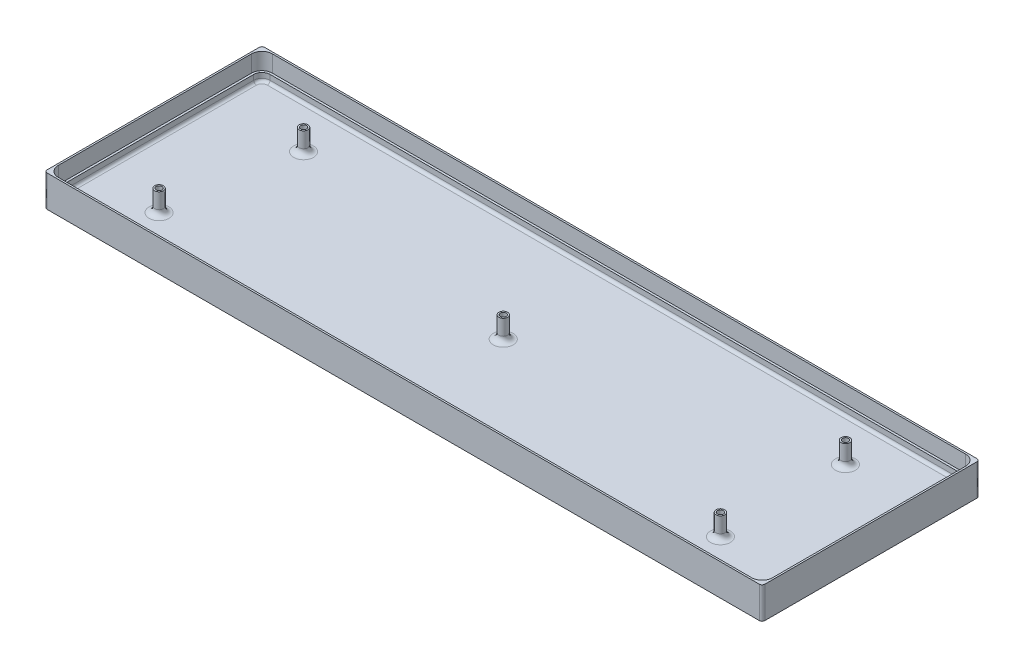
from build123d import *

# Parameters (mm, degrees)
SKETCH1_W           = 327.152
SKETCH1_H           = 99.1616
SKETCH1_W_2         = 325.5518
SKETCH1_H_2         = 97.5614
BOSS_EXTRUDE2_DEPTH = 11.2141
BOSS_EXTRUDE3_START = -11.2141
SKETCH1_3_W         = 327.152
SKETCH1_3_H         = 99.1616
SKETCH1_3_W_2       = 325.5518
SKETCH1_3_H_2       = 97.5614
BOSS_EXTRUDE3_DEPTH = 3.175
FILLET1_R           = 4.7625
FILLET2_R           = 1.27
CUT_EXTRUDE1_DEPTH  = 1.5875
SKETCH4_R           = 2
SKETCH4_R_2         = 1.35255
BOSS_EXTRUDE4_DEPTH = 9.6266
BOSS_EXTRUDE5_DEPTH = 3.5941
FILLET3_R           = 2.54
FILLET4_R           = 1.27


with BuildPart() as part:
    # Sketch1 → Boss-Extrude2 (new body)
    with BuildSketch(Plane(origin=(0, 0, 0), x_dir=(1, 0, 0), z_dir=(0, 1, 0))):
        Rectangle(SKETCH1_W, SKETCH1_H)
        Rectangle(SKETCH1_W_2, SKETCH1_H_2, mode=Mode.SUBTRACT)
    extrude(amount=-BOSS_EXTRUDE2_DEPTH)

    # Sketch1<3> → Boss-Extrude3 (add)
    # profile 1 of 2: a face of its own
    with BuildSketch(Plane(origin=(0, 0, 0), x_dir=(1, 0, 0), z_dir=(0, 1, 0)).offset(BOSS_EXTRUDE3_START)):
        Rectangle(SKETCH1_3_W, SKETCH1_3_H)
        Rectangle(SKETCH1_3_W_2, SKETCH1_3_H_2, mode=Mode.SUBTRACT)
    # profile 2 of 2: a face of its own
    with BuildSketch(Plane(origin=(0, 0, 0), x_dir=(1, 0, 0), z_dir=(0, 1, 0)).offset(BOSS_EXTRUDE3_START)):
        Rectangle(SKETCH1_3_W_2, SKETCH1_3_H_2)
    extrude(amount=-BOSS_EXTRUDE3_DEPTH)

    # Fillet1
    fillet1_edges = [part.edges().sort_by_distance(p)[0] for p in [
        (-162.7759, -5.60705, 48.7807),
        (-162.7759, -5.60705, -48.7807),
        (162.7759, -5.60705, -48.7807),
        (162.7759, -5.60705, 48.7807),
    ]]
    fillet(fillet1_edges, radius=FILLET1_R)

    # Fillet2
    fillet2_edges = [part.edges().sort_by_distance(p)[0] for p in [
        (163.576, -7.19455, 49.5808),
        (-163.576, -7.19455, 49.5808),
        (-163.576, -7.19455, -49.5808),
        (163.576, -7.19455, -49.5808),
    ]]
    fillet(fillet2_edges, radius=FILLET2_R)

    # Sketch3 → Cut-Extrude1 (cut)
    with BuildSketch(Plane.XZ.offset(14.3891)):
        with BuildLine():
            Line((-28.702, 15.5321), (28.702, 15.5321))
            ThreePointArc((28.702, 15.5321), (29.824532015, 15.067132015), (30.2895, 13.9446))
            Line((30.2895, 13.9446), (30.2895, -13.9446))
            ThreePointArc((30.2895, -13.9446), (29.824532015, -15.067132015), (28.702, -15.5321))
            Line((28.702, -15.5321), (-28.702, -15.5321))
            ThreePointArc((-28.702, -15.5321), (-29.824532015, -15.067132015), (-30.2895, -13.9446))
            Line((-30.2895, -13.9446), (-30.2895, 13.9446))
            ThreePointArc((-30.2895, 13.9446), (-29.824532015, 15.067132015), (-28.702, 15.5321))
        make_face()
    extrude(amount=-CUT_EXTRUDE1_DEPTH, mode=Mode.SUBTRACT)

    # Sketch4 → Boss-Extrude4 (add)
    # profile 1 of 5: a face of its own
    with BuildSketch(Plane(origin=(0, -11.2141, 0), x_dir=(1, 0, 0), z_dir=(0, 1, 0))):
        with Locations(Location((-123.5000008, 28.500000201, 0), (0, 0, 90))):
            Circle(SKETCH4_R)
        with Locations(Location((-123.5000008, 28.500000201, 0), (0, 0, 270))):
            Circle(SKETCH4_R_2, mode=Mode.SUBTRACT)
    # profile 2 of 5: a face of its own
    with BuildSketch(Plane(origin=(0, -11.2141, 0), x_dir=(1, 0, 0), z_dir=(0, 1, 0))):
        with Locations(Location((-132.375000713, -28.50000015, 0), (0, 0, 90))):
            Circle(SKETCH4_R)
        with Locations(Location((-132.375000713, -28.50000015, 0), (0, 0, 270))):
            Circle(SKETCH4_R_2, mode=Mode.SUBTRACT)
    # profile 3 of 5: a face of its own
    with BuildSketch(Plane(origin=(0, -11.2141, 0), x_dir=(1, 0, 0), z_dir=(0, 1, 0))):
        with Locations(Location((-4.000000001, 0, 0), (0, 0, 90))):
            Circle(SKETCH4_R)
        with Locations(Location((-4.000000001, 0, 0), (0, 0, 270))):
            Circle(SKETCH4_R_2, mode=Mode.SUBTRACT)
    # profile 4 of 5: a face of its own
    with BuildSketch(Plane(origin=(0, -11.2141, 0), x_dir=(1, 0, 0), z_dir=(0, 1, 0))):
        with Locations(Location((123.50000065, -28.50000015, 0), (0, 0, 90))):
            Circle(SKETCH4_R)
        with Locations(Location((123.50000065, -28.50000015, 0), (0, 0, 270))):
            Circle(SKETCH4_R_2, mode=Mode.SUBTRACT)
    # profile 5 of 5: a face of its own
    with BuildSketch(Plane(origin=(0, -11.2141, 0), x_dir=(1, 0, 0), z_dir=(0, 1, 0))):
        with Locations(Location((123.4999992, 28.500000201, 0), (0, 0, 90))):
            Circle(SKETCH4_R)
        with Locations(Location((123.4999992, 28.500000201, 0), (0, 0, 270))):
            Circle(SKETCH4_R_2, mode=Mode.SUBTRACT)
    extrude(amount=BOSS_EXTRUDE4_DEPTH)

    # Sketch5 → Boss-Extrude5 (add)
    with BuildSketch(Plane(origin=(0, -11.2141, 0), x_dir=(1, 0, 0), z_dir=(0, 1, 0))):
        with BuildLine():
            Line((-158.0134, -48.7807), (158.0134, -48.7807))
            ThreePointArc((158.0134, -48.7807), (161.380996045, -47.385796045), (162.7759, -44.0182))
            Line((162.7759, -44.0182), (162.7759, 44.0182))
            ThreePointArc((162.7759, 44.0182), (161.380996045, 47.385796045), (158.0134, 48.7807))
            Line((158.0134, 48.7807), (-158.0134, 48.7807))
            ThreePointArc((-158.0134, 48.7807), (-161.380996045, 47.385796045), (-162.7759, 44.0182))
            Line((-162.7759, 44.0182), (-162.7759, -44.0182))
            ThreePointArc((-162.7759, -44.0182), (-161.380996045, -47.385796045), (-158.0134, -48.7807))
        make_face()
        with BuildLine():
            Line((-158.0134, -47.7647), (158.0134, -47.7647))
            ThreePointArc((158.0134, -47.7647), (160.662575556, -46.667375556), (161.7599, -44.0182))
            Line((161.7599, -44.0182), (161.7599, 44.0182))
            ThreePointArc((161.7599, 44.0182), (160.662575556, 46.667375556), (158.0134, 47.7647))
            Line((158.0134, 47.7647), (-158.0134, 47.7647))
            ThreePointArc((-158.0134, 47.7647), (-160.662575556, 46.667375556), (-161.7599, 44.0182))
            Line((-161.7599, 44.0182), (-161.7599, -44.0182))
            ThreePointArc((-161.7599, -44.0182), (-160.662575556, -46.667375556), (-158.0134, -47.7647))
        make_face(mode=Mode.SUBTRACT)
    extrude(amount=BOSS_EXTRUDE5_DEPTH)

    # Fillet3
    fillet3_edges = [part.edges().sort_by_distance(p)[0] for p in [
        (-123.5000008, -11.2141, -26.500000201),
        (-132.375000713, -11.2141, 30.50000015),
        (-4.000000001, -11.2141, 2),
        (123.50000065, -11.2141, 30.50000015),
        (123.4999992, -11.2141, -26.500000201),
    ]]
    fillet(fillet3_edges, radius=FILLET3_R)

    # Fillet4
    fillet4_edges = [part.edges().sort_by_distance(p)[0] for p in [
        (-160.662575556, -11.2141, 46.667375556),
        (0, -11.2141, 47.7647),
        (160.662575556, -11.2141, 46.667375556),
        (161.7599, -11.2141, 0),
        (160.662575556, -11.2141, -46.667375556),
        (0, -11.2141, -47.7647),
        (-160.662575556, -11.2141, -46.667375556),
        (-161.7599, -11.2141, 0),
    ]]
    fillet(fillet4_edges, radius=FILLET4_R)


solid = part.part
